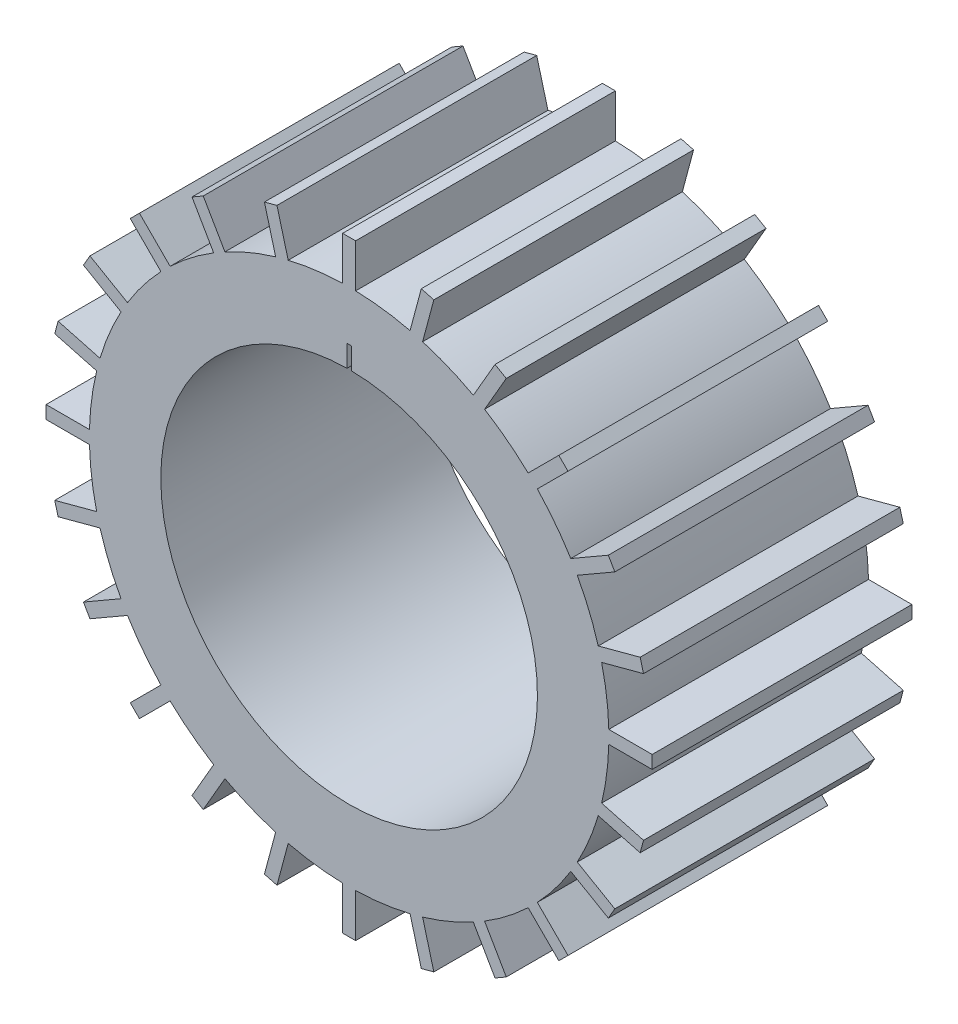
from build123d import *

# Parameters (mm, degrees)
SKETCH1_R           = 60
SKETCH1_R_2         = 43.5
EXTRUSION1_DEPTH    = 60
EXTRUSION3_START    = -60
EXTRUSION3_DEPTH    = 60
BOSS_EXTRUDE2_START = -60
BOSS_EXTRUDE2_DEPTH = 60


with BuildPart() as part:
    # Sketch1 → Extrusion1 (new body)
    with BuildSketch(Plane.XY):
        Circle(SKETCH1_R)
        Circle(SKETCH1_R_2, mode=Mode.SUBTRACT)
    extrude(amount=EXTRUSION1_DEPTH)

    # Sketch3 → Extrusion3 (cut)
    with BuildSketch(Plane.XY.offset(60).offset(EXTRUSION3_START)):
        with BuildLine():
            Line((-0.5, 48.5), (-0.5, 43.497126342))
            ThreePointArc((-0.5, 43.497126342), (0, 43.5), (0.5, 43.497126342))
            Line((0.5, 43.497126342), (0.5, 48.5))
            Line((0.5, 48.5), (-0.5, 48.5))
        make_face()
    extrude(amount=EXTRUSION3_DEPTH, mode=Mode.SUBTRACT)

    # Sketch5 → Boss-Extrude2 (add)
    with BuildSketch(Plane.XY.offset(60).offset(BOSS_EXTRUDE2_START)):
        with BuildLine():
            Line((14.075400351, 58.325664205), (16.668444418, 68.003036408))
            Line((16.668444418, 68.003036408), (19.566221897, 67.226579273))
            Line((19.566221897, 67.226579273), (16.97317783, 57.54920707))
            ThreePointArc((16.97317783, 57.54920707), (15.529142706, 57.955549577), (14.075400351, 58.325664205))
        make_face()
        with BuildLine():
            Line((1.5, 59.981247069), (1.5, 70))
            Line((1.5, 70), (-1.5, 70))
            Line((-1.5, 70), (-1.5, 59.981247069))
            ThreePointArc((-1.5, 59.981247069), (0, 60), (1.5, 59.981247069))
        make_face()
        with BuildLine():
            Line((28.691585429, 52.695283713), (33.700961894, 61.371778265))
            Line((33.700961894, 61.371778265), (36.299038106, 59.871778265))
            Line((36.299038106, 59.871778265), (31.28966164, 51.195283713))
            ThreePointArc((31.28966164, 51.195283713), (30, 51.961524227), (28.691585429, 52.695283713))
        make_face()
        with BuildLine():
            Line((41.352486375, 43.473806719), (48.436814511, 50.558134855))
            Line((48.436814511, 50.558134855), (50.558134855, 48.436814511))
            Line((50.558134855, 48.436814511), (43.473806719, 41.352486375))
            ThreePointArc((43.473806719, 41.352486375), (42.426406871, 42.426406871), (41.352486375, 43.473806719))
        make_face()
        with BuildLine():
            Line((51.195283713, 31.28966164), (59.871778265, 36.299038106))
            Line((59.871778265, 36.299038106), (61.371778265, 33.700961894))
            Line((61.371778265, 33.700961894), (52.695283713, 28.691585429))
            ThreePointArc((52.695283713, 28.691585429), (51.961524227, 30), (51.195283713, 31.28966164))
        make_face()
        with BuildLine():
            Line((57.54920707, 16.97317783), (67.226579273, 19.566221897))
            Line((67.226579273, 19.566221897), (68.003036408, 16.668444418))
            Line((68.003036408, 16.668444418), (58.325664205, 14.075400351))
            ThreePointArc((58.325664205, 14.075400351), (57.955549577, 15.529142706), (57.54920707, 16.97317783))
        make_face()
        with BuildLine():
            Line((59.981247069, 1.5), (70, 1.5))
            Line((70, 1.5), (70, -1.5))
            Line((70, -1.5), (59.981247069, -1.5))
            ThreePointArc((59.981247069, -1.5), (60, 0), (59.981247069, 1.5))
        make_face()
        with BuildLine():
            Line((58.325664205, -14.075400351), (68.003036408, -16.668444418))
            Line((68.003036408, -16.668444418), (67.226579273, -19.566221897))
            Line((67.226579273, -19.566221897), (57.54920707, -16.97317783))
            ThreePointArc((57.54920707, -16.97317783), (57.955549577, -15.529142706), (58.325664205, -14.075400351))
        make_face()
        with BuildLine():
            Line((52.695283713, -28.691585429), (61.371778265, -33.700961894))
            Line((61.371778265, -33.700961894), (59.871778265, -36.299038106))
            Line((59.871778265, -36.299038106), (51.195283713, -31.28966164))
            ThreePointArc((51.195283713, -31.28966164), (51.961524227, -30), (52.695283713, -28.691585429))
        make_face()
        with BuildLine():
            Line((43.473806719, -41.352486375), (50.558134855, -48.436814511))
            Line((50.558134855, -48.436814511), (48.436814511, -50.558134855))
            Line((48.436814511, -50.558134855), (41.352486375, -43.473806719))
            ThreePointArc((41.352486375, -43.473806719), (42.426406871, -42.426406871), (43.473806719, -41.352486375))
        make_face()
        with BuildLine():
            Line((31.28966164, -51.195283713), (36.299038106, -59.871778265))
            Line((36.299038106, -59.871778265), (33.700961894, -61.371778265))
            Line((33.700961894, -61.371778265), (28.691585429, -52.695283713))
            ThreePointArc((28.691585429, -52.695283713), (30, -51.961524227), (31.28966164, -51.195283713))
        make_face()
        with BuildLine():
            Line((16.97317783, -57.54920707), (19.566221897, -67.226579273))
            Line((19.566221897, -67.226579273), (16.668444418, -68.003036408))
            Line((16.668444418, -68.003036408), (14.075400351, -58.325664205))
            ThreePointArc((14.075400351, -58.325664205), (15.529142706, -57.955549577), (16.97317783, -57.54920707))
        make_face()
        with BuildLine():
            Line((1.5, -59.981247069), (1.5, -70))
            Line((1.5, -70), (-1.5, -70))
            Line((-1.5, -70), (-1.5, -59.981247069))
            ThreePointArc((-1.5, -59.981247069), (0, -60), (1.5, -59.981247069))
        make_face()
        with BuildLine():
            Line((-14.075400351, -58.325664205), (-16.668444418, -68.003036408))
            Line((-16.668444418, -68.003036408), (-19.566221897, -67.226579273))
            Line((-19.566221897, -67.226579273), (-16.97317783, -57.54920707))
            ThreePointArc((-16.97317783, -57.54920707), (-15.529142706, -57.955549577), (-14.075400351, -58.325664205))
        make_face()
        with BuildLine():
            Line((-28.691585429, -52.695283713), (-33.700961894, -61.371778265))
            Line((-33.700961894, -61.371778265), (-36.299038106, -59.871778265))
            Line((-36.299038106, -59.871778265), (-31.28966164, -51.195283713))
            ThreePointArc((-31.28966164, -51.195283713), (-30, -51.961524227), (-28.691585429, -52.695283713))
        make_face()
        with BuildLine():
            Line((-41.352486375, -43.473806719), (-48.436814511, -50.558134855))
            Line((-48.436814511, -50.558134855), (-50.558134855, -48.436814511))
            Line((-50.558134855, -48.436814511), (-43.473806719, -41.352486375))
            ThreePointArc((-43.473806719, -41.352486375), (-42.426406871, -42.426406871), (-41.352486375, -43.473806719))
        make_face()
        with BuildLine():
            Line((-51.195283713, -31.28966164), (-59.871778265, -36.299038106))
            Line((-59.871778265, -36.299038106), (-61.371778265, -33.700961894))
            Line((-61.371778265, -33.700961894), (-52.695283713, -28.691585429))
            ThreePointArc((-52.695283713, -28.691585429), (-51.961524227, -30), (-51.195283713, -31.28966164))
        make_face()
        with BuildLine():
            Line((-57.54920707, -16.97317783), (-67.226579273, -19.566221897))
            Line((-67.226579273, -19.566221897), (-68.003036408, -16.668444418))
            Line((-68.003036408, -16.668444418), (-58.325664205, -14.075400351))
            ThreePointArc((-58.325664205, -14.075400351), (-57.955549577, -15.529142706), (-57.54920707, -16.97317783))
        make_face()
        with BuildLine():
            Line((-59.981247069, -1.5), (-70, -1.5))
            Line((-70, -1.5), (-70, 1.5))
            Line((-70, 1.5), (-59.981247069, 1.5))
            ThreePointArc((-59.981247069, 1.5), (-60, 0), (-59.981247069, -1.5))
        make_face()
        with BuildLine():
            Line((-58.325664205, 14.075400351), (-68.003036408, 16.668444418))
            Line((-68.003036408, 16.668444418), (-67.226579273, 19.566221897))
            Line((-67.226579273, 19.566221897), (-57.54920707, 16.97317783))
            ThreePointArc((-57.54920707, 16.97317783), (-57.955549577, 15.529142706), (-58.325664205, 14.075400351))
        make_face()
        with BuildLine():
            Line((-52.695283713, 28.691585429), (-61.371778265, 33.700961894))
            Line((-61.371778265, 33.700961894), (-59.871778265, 36.299038106))
            Line((-59.871778265, 36.299038106), (-51.195283713, 31.28966164))
            ThreePointArc((-51.195283713, 31.28966164), (-51.961524227, 30), (-52.695283713, 28.691585429))
        make_face()
        with BuildLine():
            Line((-43.473806719, 41.352486375), (-50.558134855, 48.436814511))
            Line((-50.558134855, 48.436814511), (-48.436814511, 50.558134855))
            Line((-48.436814511, 50.558134855), (-41.352486375, 43.473806719))
            ThreePointArc((-41.352486375, 43.473806719), (-42.426406871, 42.426406871), (-43.473806719, 41.352486375))
        make_face()
        with BuildLine():
            Line((-31.28966164, 51.195283713), (-36.299038106, 59.871778265))
            Line((-36.299038106, 59.871778265), (-33.700961894, 61.371778265))
            Line((-33.700961894, 61.371778265), (-28.691585429, 52.695283713))
            ThreePointArc((-28.691585429, 52.695283713), (-30, 51.961524227), (-31.28966164, 51.195283713))
        make_face()
        with BuildLine():
            Line((-16.97317783, 57.54920707), (-19.566221897, 67.226579273))
            Line((-19.566221897, 67.226579273), (-16.668444418, 68.003036408))
            Line((-16.668444418, 68.003036408), (-14.075400351, 58.325664205))
            ThreePointArc((-14.075400351, 58.325664205), (-15.529142706, 57.955549577), (-16.97317783, 57.54920707))
        make_face()
    extrude(amount=BOSS_EXTRUDE2_DEPTH)


solid = part.part
